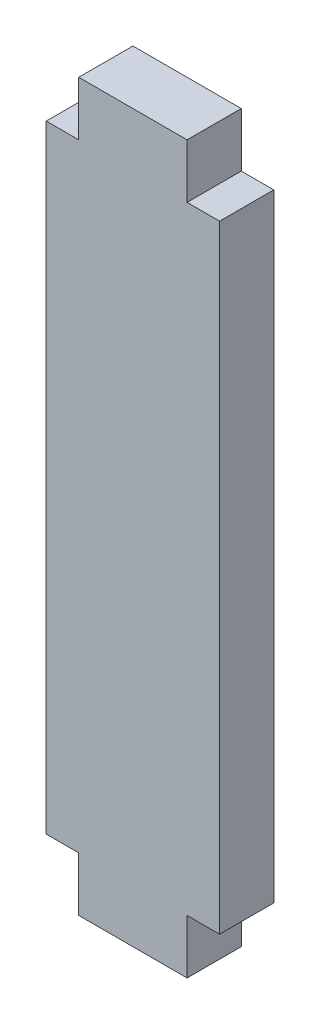
from build123d import *

# Parameters (mm, degrees)
BOSS_EXTRUDE1_DEPTH = 5


with BuildPart() as part:
    # Sketch2 → Boss-Extrude1 (new body)
    with BuildSketch(Plane.XY):
        Polygon((-5, 28.5), (-8, 28.5), (-8, -28.5), (-5, -28.5), (-5, -33.5), (5, -33.5), (5, -28.5), (8, -28.5), (8, 28.5), (5, 28.5), (5, 33.5), (-5, 33.5), align=None)
    extrude(amount=BOSS_EXTRUDE1_DEPTH)


solid = part.part
